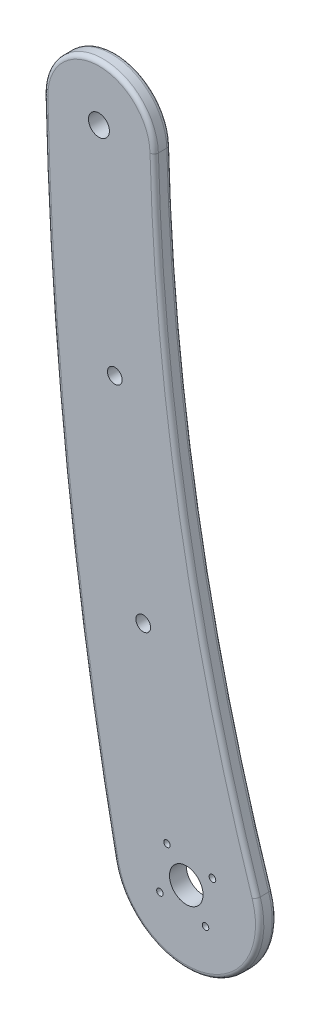
from build123d import *

# Parameters (mm, degrees)
SKETCH4_R               = 4
SKETCH4_R_2             = 2.5
SKETCH4_R_3             = 1.75
BOSS_EXTRUDE2_DEPTH     = 2
FILLET3_R               = 1
CUT_EXTRUDE1_DEPTH      = 225.288694563
CUT_EXTRUDE1_DEPTH_BACK = 225.288694563
SKETCH6_R               = 0.767868533
SKETCH6_R_2             = 0.771761199
SKETCH6_R_3             = 0.768034618
SKETCH6_R_4             = 0.795284138


with BuildPart() as part:
    # Sketch4 → Boss-Extrude2 (new, symmetric)
    with BuildSketch(Plane.XY):
        with BuildLine():
            ThreePointArc((-37.367897149, 54.387204077), (-49.125443785, 128.867751214), (-54.236117249, 204.097218987))
            ThreePointArc((-54.236117249, 204.097218987), (-41.377914553, 217.590696941), (-27.867941637, 204.749826423))
            ThreePointArc((-27.867941637, 204.749826423), (-20.824641361, 133.142032668), (-3.576140657, 63.286657579))
            ThreePointArc((-3.576140657, 63.286657579), (-15.763142173, 40.957044634), (-37.367897149, 54.387204077))
        make_face()
        with Locations((-20.22, 57.88)):
            Circle(SKETCH4_R, mode=Mode.SUBTRACT)
        with Locations((-41.051610566, 204.406598272)):
            Circle(SKETCH4_R_2, mode=Mode.SUBTRACT)
        with Locations((-37.268473007, 154.549924996)):
            Circle(SKETCH4_R_3, mode=Mode.SUBTRACT)
        with Locations((-30.482103359, 106.815562065)):
            Circle(SKETCH4_R_3, mode=Mode.SUBTRACT)
    extrude(amount=BOSS_EXTRUDE2_DEPTH, both=True)

    # Fillet3
    fillet3_edges = [part.edges().sort_by_distance(p)[0] for p in [
        (-41.377914553, 217.590696941, -2),
        (-20.824641361, 133.142032668, -2),
        (-15.763142173, 40.957044634, -2),
        (-49.125443785, 128.867751214, -2),
        (-49.125443785, 128.867751214, 2),
        (-15.763142173, 40.957044634, 2),
        (-20.824641361, 133.142032668, 2),
        (-41.377914553, 217.590696941, 2),
    ]]
    fillet(fillet3_edges, radius=FILLET3_R)

    # Sketch6 → Cut-Extrude1 (cut, two sides: drawn at the far end of the back side and taken through both)
    with BuildSketch(Plane(origin=(0, 0, -2), x_dir=(-1, 0, 0), z_dir=(0, 0, -1)).offset(-CUT_EXTRUDE1_DEPTH_BACK)):
        with Locations((24.81448084, 64.15193249)):
            Circle(SKETCH6_R)
        with Locations((26.515189166, 53.299256498)):
            Circle(SKETCH6_R_2)
        with Locations((15.627794635, 51.635896996)):
            Circle(SKETCH6_R_3)
        with Locations((13.984842021, 62.426172158)):
            Circle(SKETCH6_R_4)
    extrude(amount=CUT_EXTRUDE1_DEPTH + CUT_EXTRUDE1_DEPTH_BACK, mode=Mode.SUBTRACT)


solid = part.part
